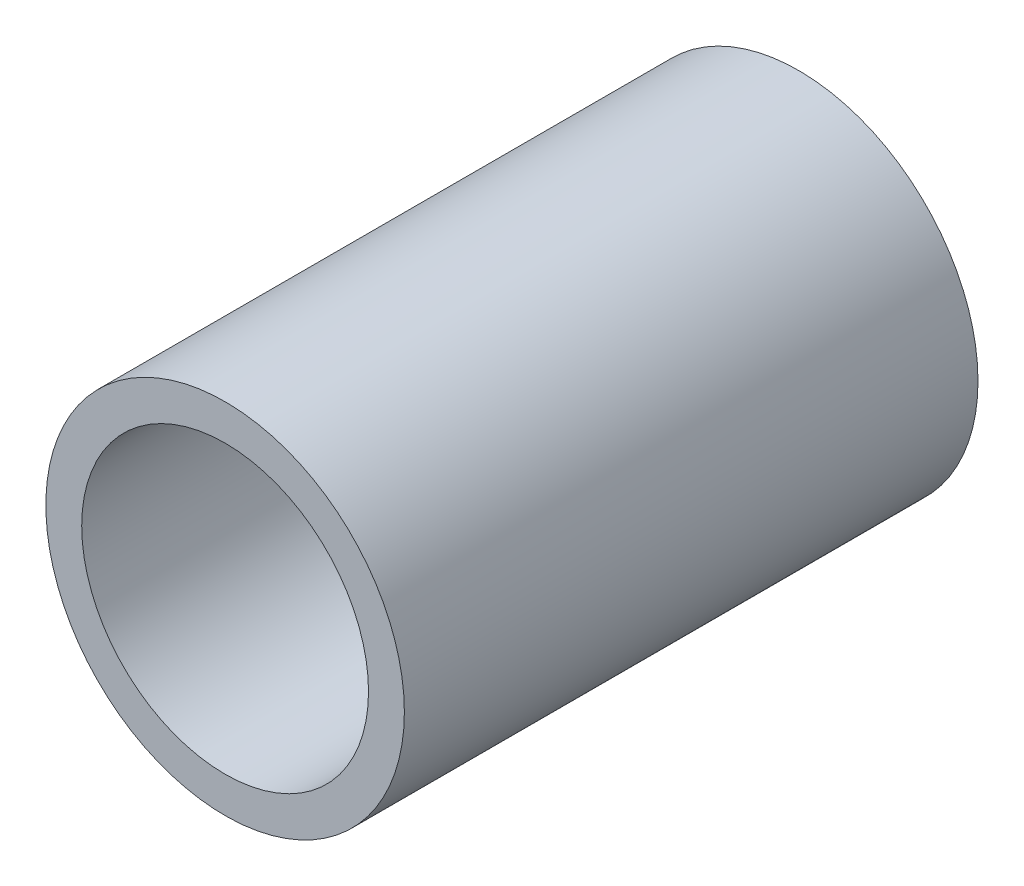
from build123d import *

# Parameters (mm, degrees)
SKETCH1_R           = 7.9375
SKETCH1_R_2         = 6.35
BOSS_EXTRUDE1_DEPTH = 25.4


with BuildPart() as part:
    # Sketch1 → Boss-Extrude1 (new body)
    with BuildSketch(Plane.XY):
        Circle(SKETCH1_R)
        Circle(SKETCH1_R_2, mode=Mode.SUBTRACT)
    extrude(amount=BOSS_EXTRUDE1_DEPTH)


solid = part.part
